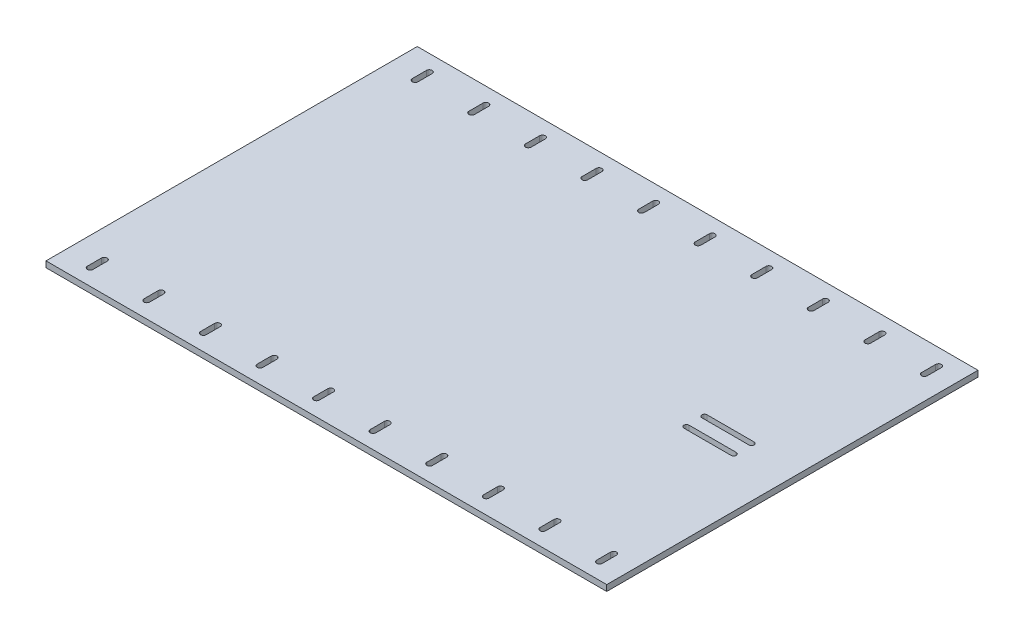
from build123d import *

# Parameters (mm, degrees)
SKETCH1_W           = 609.6
SKETCH1_H           = 393.7
BOSS_EXTRUDE1_DEPTH = 6.35
CUT_EXTRUDE1_REACH  = 727.708
SKETCH2_W           = 15
SKETCH2_H           = 393.7


with BuildPart() as part:
    # Sketch1 → Boss-Extrude1 (new body)
    with BuildSketch(Plane(origin=(0, 0, 0), x_dir=(1, 0, 0), z_dir=(0, 1, 0))):
        with Locations((304.8, 196.85)):
            Rectangle(SKETCH1_W, SKETCH1_H)
        with BuildLine():
            Line((587.8, 32.05), (587.8, 17.05))
            ThreePointArc((587.8, 17.05), (584.8, 14.05), (581.8, 17.05))
            Line((581.8, 17.05), (581.8, 32.05))
            ThreePointArc((581.8, 32.05), (584.8, 35.05), (587.8, 32.05))
        make_face(mode=Mode.SUBTRACT)
        with BuildLine():
            Line((527.8, 32.05), (527.8, 17.05))
            ThreePointArc((527.8, 17.05), (524.8, 14.05), (521.8, 17.05))
            Line((521.8, 17.05), (521.8, 32.05))
            ThreePointArc((521.8, 32.05), (524.8, 35.05), (527.8, 32.05))
        make_face(mode=Mode.SUBTRACT)
        with BuildLine():
            Line((467.8, 32.05), (467.8, 17.05))
            ThreePointArc((467.8, 17.05), (464.8, 14.05), (461.8, 17.05))
            Line((461.8, 17.05), (461.8, 32.05))
            ThreePointArc((461.8, 32.05), (464.8, 35.05), (467.8, 32.05))
        make_face(mode=Mode.SUBTRACT)
        with BuildLine():
            Line((407.8, 32.05), (407.8, 17.05))
            ThreePointArc((407.8, 17.05), (404.8, 14.05), (401.8, 17.05))
            Line((401.8, 17.05), (401.8, 32.05))
            ThreePointArc((401.8, 32.05), (404.8, 35.05), (407.8, 32.05))
        make_face(mode=Mode.SUBTRACT)
        with BuildLine():
            Line((347.8, 32.05), (347.8, 17.05))
            ThreePointArc((347.8, 17.05), (344.8, 14.05), (341.8, 17.05))
            Line((341.8, 17.05), (341.8, 32.05))
            ThreePointArc((341.8, 32.05), (344.8, 35.05), (347.8, 32.05))
        make_face(mode=Mode.SUBTRACT)
        with BuildLine():
            Line((287.8, 32.05), (287.8, 17.05))
            ThreePointArc((287.8, 17.05), (284.8, 14.05), (281.8, 17.05))
            Line((281.8, 17.05), (281.8, 32.05))
            ThreePointArc((281.8, 32.05), (284.8, 35.05), (287.8, 32.05))
        make_face(mode=Mode.SUBTRACT)
        with BuildLine():
            Line((227.8, 32.05), (227.8, 17.05))
            ThreePointArc((227.8, 17.05), (224.8, 14.05), (221.8, 17.05))
            Line((221.8, 17.05), (221.8, 32.05))
            ThreePointArc((221.8, 32.05), (224.8, 35.05), (227.8, 32.05))
        make_face(mode=Mode.SUBTRACT)
        with BuildLine():
            Line((167.8, 32.05), (167.8, 17.05))
            ThreePointArc((167.8, 17.05), (164.8, 14.05), (161.8, 17.05))
            Line((161.8, 17.05), (161.8, 32.05))
            ThreePointArc((161.8, 32.05), (164.8, 35.05), (167.8, 32.05))
        make_face(mode=Mode.SUBTRACT)
        with BuildLine():
            Line((107.8, 32.05), (107.8, 17.05))
            ThreePointArc((107.8, 17.05), (104.8, 14.05), (101.8, 17.05))
            Line((101.8, 17.05), (101.8, 32.05))
            ThreePointArc((101.8, 32.05), (104.8, 35.05), (107.8, 32.05))
        make_face(mode=Mode.SUBTRACT)
        with BuildLine():
            Line((47.8, 32.05), (47.8, 17.05))
            ThreePointArc((47.8, 17.05), (44.8, 14.05), (41.8, 17.05))
            Line((41.8, 17.05), (41.8, 32.05))
            ThreePointArc((41.8, 32.05), (44.8, 35.05), (47.8, 32.05))
        make_face(mode=Mode.SUBTRACT)
        with BuildLine():
            Line((527.8, 376.65), (527.8, 361.65))
            ThreePointArc((527.8, 361.65), (524.8, 358.65), (521.8, 361.65))
            Line((521.8, 361.65), (521.8, 376.65))
            ThreePointArc((521.8, 376.65), (524.8, 379.65), (527.8, 376.65))
        make_face(mode=Mode.SUBTRACT)
        with BuildLine():
            Line((467.8, 376.65), (467.8, 361.65))
            ThreePointArc((467.8, 361.65), (464.8, 358.65), (461.8, 361.65))
            Line((461.8, 361.65), (461.8, 376.65))
            ThreePointArc((461.8, 376.65), (464.8, 379.65), (467.8, 376.65))
        make_face(mode=Mode.SUBTRACT)
        with BuildLine():
            Line((407.8, 376.65), (407.8, 361.65))
            ThreePointArc((407.8, 361.65), (404.8, 358.65), (401.8, 361.65))
            Line((401.8, 361.65), (401.8, 376.65))
            ThreePointArc((401.8, 376.65), (404.8, 379.65), (407.8, 376.65))
        make_face(mode=Mode.SUBTRACT)
        with BuildLine():
            Line((347.8, 376.65), (347.8, 361.65))
            ThreePointArc((347.8, 361.65), (344.8, 358.65), (341.8, 361.65))
            Line((341.8, 361.65), (341.8, 376.65))
            ThreePointArc((341.8, 376.65), (344.8, 379.65), (347.8, 376.65))
        make_face(mode=Mode.SUBTRACT)
        with BuildLine():
            Line((287.8, 376.65), (287.8, 361.65))
            ThreePointArc((287.8, 361.65), (284.8, 358.65), (281.8, 361.65))
            Line((281.8, 361.65), (281.8, 376.65))
            ThreePointArc((281.8, 376.65), (284.8, 379.65), (287.8, 376.65))
        make_face(mode=Mode.SUBTRACT)
        with BuildLine():
            Line((227.8, 376.65), (227.8, 361.65))
            ThreePointArc((227.8, 361.65), (224.8, 358.65), (221.8, 361.65))
            Line((221.8, 361.65), (221.8, 376.65))
            ThreePointArc((221.8, 376.65), (224.8, 379.65), (227.8, 376.65))
        make_face(mode=Mode.SUBTRACT)
        with BuildLine():
            Line((167.8, 376.65), (167.8, 361.65))
            ThreePointArc((167.8, 361.65), (164.8, 358.65), (161.8, 361.65))
            Line((161.8, 361.65), (161.8, 376.65))
            ThreePointArc((161.8, 376.65), (164.8, 379.65), (167.8, 376.65))
        make_face(mode=Mode.SUBTRACT)
        with BuildLine():
            Line((107.8, 376.65), (107.8, 361.65))
            ThreePointArc((107.8, 361.65), (104.8, 358.65), (101.8, 361.65))
            Line((101.8, 361.65), (101.8, 376.65))
            ThreePointArc((101.8, 376.65), (104.8, 379.65), (107.8, 376.65))
        make_face(mode=Mode.SUBTRACT)
        with BuildLine():
            Line((47.8, 376.65), (47.8, 361.65))
            ThreePointArc((47.8, 361.65), (44.8, 358.65), (41.8, 361.65))
            Line((41.8, 361.65), (41.8, 376.65))
            ThreePointArc((41.8, 376.65), (44.8, 379.65), (47.8, 376.65))
        make_face(mode=Mode.SUBTRACT)
        with BuildLine():
            Line((587.8, 376.65), (587.8, 361.65))
            ThreePointArc((587.8, 361.65), (584.8, 358.65), (581.8, 361.65))
            Line((581.8, 361.65), (581.8, 376.65))
            ThreePointArc((581.8, 376.65), (584.8, 379.65), (587.8, 376.65))
        make_face(mode=Mode.SUBTRACT)
        with BuildLine():
            Line((506.85, 209.125), (556.85, 209.125))
            ThreePointArc((556.85, 209.125), (559.6, 206.375), (556.85, 203.625))
            Line((556.85, 203.625), (506.85, 203.625))
            ThreePointArc((506.85, 203.625), (504.1, 206.375), (506.85, 209.125))
        make_face(mode=Mode.SUBTRACT)
        with BuildLine():
            Line((506.85, 190.075), (556.85, 190.075))
            ThreePointArc((556.85, 190.075), (559.6, 187.325), (556.85, 184.575))
            Line((556.85, 184.575), (506.85, 184.575))
            ThreePointArc((506.85, 184.575), (504.1, 187.325), (506.85, 190.075))
        make_face(mode=Mode.SUBTRACT)
    extrude(amount=BOSS_EXTRUDE1_DEPTH)

    # Sketch2 → Cut-Extrude1 (cut, up to next)
    with BuildSketch(Plane(origin=(0, 6.35, 0), x_dir=(1, 0, 0), z_dir=(0, 1, 0)), mode=Mode.PRIVATE) as cut_extrude1_sk1:
        with Locations((7.5, 196.85)):
            Rectangle(SKETCH2_W, SKETCH2_H)
    cut_extrude1_tool1 = extrude(cut_extrude1_sk1.sketch, amount=-CUT_EXTRUDE1_REACH, mode=Mode.PRIVATE) & part.part
    add(cut_extrude1_tool1.solids().sort_by_distance((7.5, 6.35, -196.85))[0], mode=Mode.SUBTRACT)


solid = part.part
